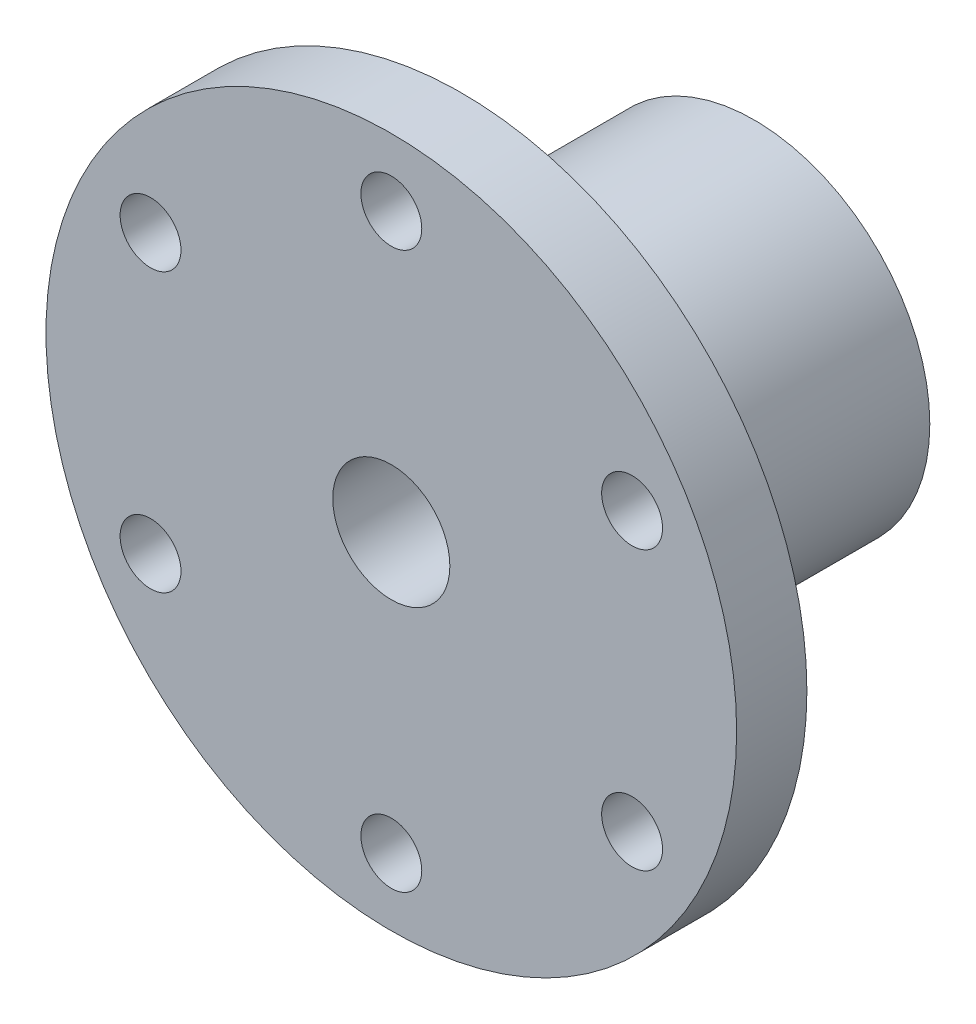
from build123d import *

# Parameters (mm, degrees)
SKETCH1_R           = 29.5
SKETCH1_R_2         = 2.6
BOSS_EXTRUDE1_DEPTH = 6
SKETCH2_W           = 25
SKETCH2_H           = 15
FILLET1_R           = 1
SKETCH3_R           = 5
CUT_EXTRUDE1_DEPTH  = 31


with BuildPart() as part:
    # Sketch1 → Boss-Extrude1 (new body)
    with BuildSketch(Plane.XY):
        Circle(SKETCH1_R)
        with Locations((0, 23.75)):
            Circle(SKETCH1_R_2, mode=Mode.SUBTRACT)
        with Locations((20.56810334, 11.875)):
            Circle(SKETCH1_R_2, mode=Mode.SUBTRACT)
        with Locations((20.56810334, -11.875)):
            Circle(SKETCH1_R_2, mode=Mode.SUBTRACT)
        with Locations((0, -23.75)):
            Circle(SKETCH1_R_2, mode=Mode.SUBTRACT)
        with Locations((-20.56810334, -11.875)):
            Circle(SKETCH1_R_2, mode=Mode.SUBTRACT)
        with Locations((-20.56810334, 11.875)):
            Circle(SKETCH1_R_2, mode=Mode.SUBTRACT)
    extrude(amount=BOSS_EXTRUDE1_DEPTH)

    # Sketch2 → Revolve1 (revolve)
    with BuildSketch(Plane(origin=(0, 0, 0), x_dir=(0, 0, -1), z_dir=(1, 0, 0)), mode=Mode.PRIVATE) as revolve1_sk:
        with Locations((12.5, 7.5)):
            Rectangle(SKETCH2_W, SKETCH2_H)
    revolve(revolve1_sk.sketch.rotate(Axis((0, 0, 0), (0, 0, -1)), 90), axis=Axis((0, 0, 0), (0, 0, -1)))

    # Fillet1
    fillet1_edges = [part.edges().sort_by_distance(p)[0] for p in [
        (-15, 0, 0),
    ]]
    fillet(fillet1_edges, radius=FILLET1_R)

    # Sketch3 → Cut-Extrude1 (cut)
    with BuildSketch(Plane(origin=(0, 0, -25), x_dir=(-1, 0, 0), z_dir=(0, 0, -1))):
        Circle(SKETCH3_R)
    extrude(amount=-CUT_EXTRUDE1_DEPTH, mode=Mode.SUBTRACT)


solid = part.part
